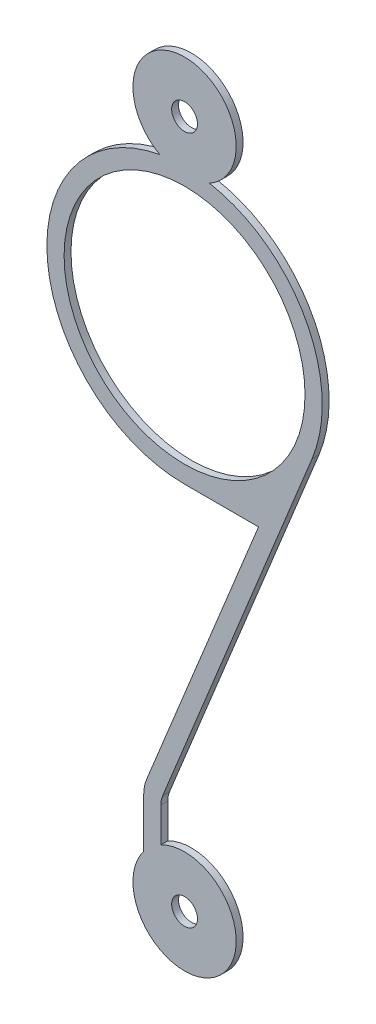
from build123d import *

# Parameters (mm, degrees)
SKETCH1_R           = 0.375
SKETCH1_R_2         = 3.5
BOSS_EXTRUDE1_DEPTH = 0.1


with BuildPart() as part:
    # Sketch1 → Boss-Extrude1 (new, symmetric)
    with BuildSketch(Plane.XY):
        with BuildLine():
            Line((-0.636628274, -7.407290054), (3.704019046, 3.239952681))
            ThreePointArc((3.704019046, 3.239952681), (3.507926477, 6.672095687), (0.720779018, 8.68452381))
            ThreePointArc((0.720779018, 8.68452381), (0, 11.5), (-0.720779018, 8.68452381))
            ThreePointArc((-0.720779018, 8.68452381), (-3.983597321, 4.388126568), (0, 0.75))
            Line((0, 0.75), (2.148965927, 0.75))
            Line((2.148965927, 0.75), (-1.099630654, -7.218534139))
            ThreePointArc((-1.099630654, -7.218534139), (-1.165325631, -7.4384166), (-1.1875, -7.666829437))
            Line((-1.1875, -7.666829437), (-1.1875, -9.083570106))
            ThreePointArc((-1.1875, -9.083570106), (0.960377242, -11.152248043), (-0.6875, -8.666829437))
            Line((-0.6875, -8.666829437), (-0.6875, -7.666829437))
            ThreePointArc((-0.6875, -7.666829437), (-0.674662207, -7.534590426), (-0.636628274, -7.407290054))
        make_face()
        with Locations((0, -10)):
            Circle(SKETCH1_R, mode=Mode.SUBTRACT)
        with Locations((0, 10)):
            Circle(SKETCH1_R, mode=Mode.SUBTRACT)
        with Locations((0, 4.75)):
            Circle(SKETCH1_R_2, mode=Mode.SUBTRACT)
    extrude(amount=BOSS_EXTRUDE1_DEPTH, both=True)


solid = part.part
